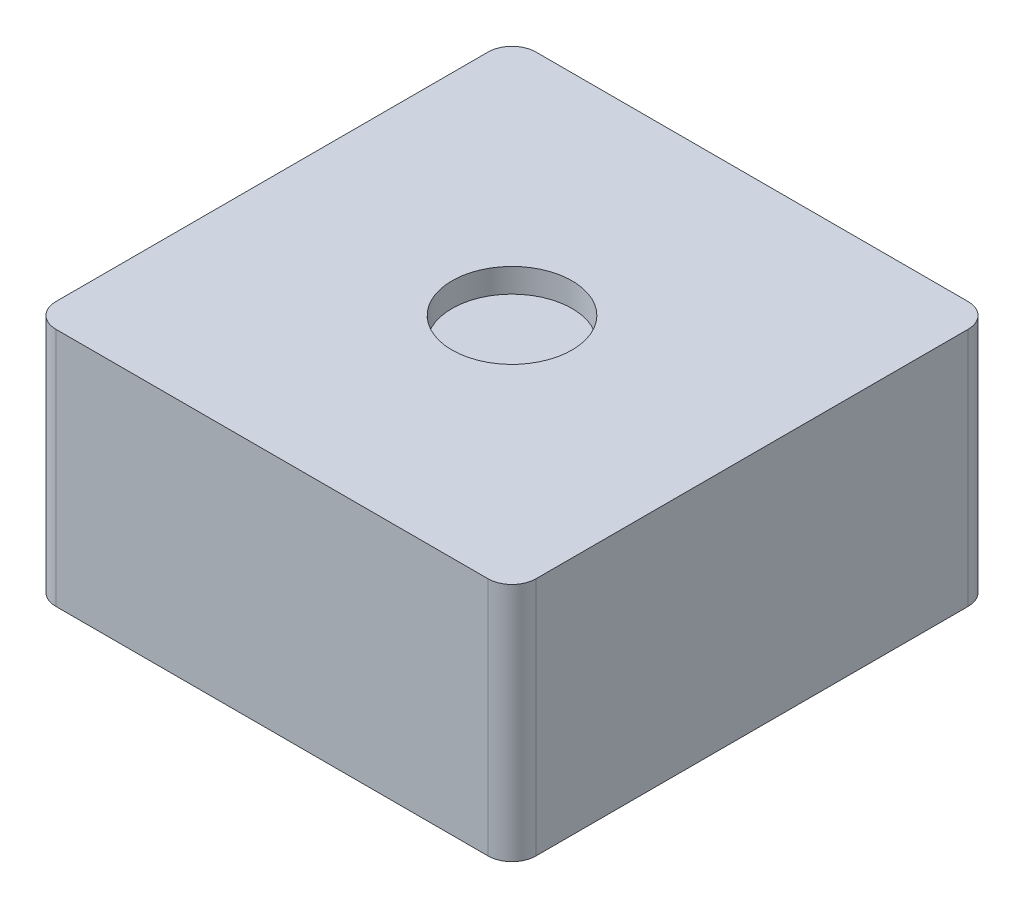
from build123d import *

# Parameters (mm, degrees)
SKETCH_1_W          = 4
SKETCH_1_H          = 4
EXTRUDE_1_DEPTH     = 2
SKETCH_2_R          = 0.5
CUT_EXTRUDE_1_DEPTH = 0.2
FILLET_1_R          = 0.2


with BuildPart() as part:
    # 草图1 → 凸台-拉伸1 (new body)
    with BuildSketch(Plane(origin=(0, 0, 0), x_dir=(1, 0, 0), z_dir=(0, 1, 0))):
        with Locations((0.476190476, 0.047619048)):
            Rectangle(SKETCH_1_W, SKETCH_1_H)
    extrude(amount=EXTRUDE_1_DEPTH)

    # 草图2 → 切除-拉伸1 (cut)
    with BuildSketch(Plane(origin=(0, 2, 0), x_dir=(1, 0, 0), z_dir=(0, 1, 0))):
        with Locations(Location((0.476190476, 0.047619048, 0), (0, 0, 270))):
            Circle(SKETCH_2_R)
    extrude(amount=-CUT_EXTRUDE_1_DEPTH, mode=Mode.SUBTRACT)

    # 圆角1
    fillet_1_edges = [part.edges().sort_by_distance(p)[0] for p in [
        (-1.523809524, 1, -2.047619048),
        (2.476190476, 1, -2.047619048),
        (2.476190476, 1, 1.952380952),
        (-1.523809524, 1, 1.952380952),
    ]]
    fillet(fillet_1_edges, radius=FILLET_1_R)


solid = part.part
